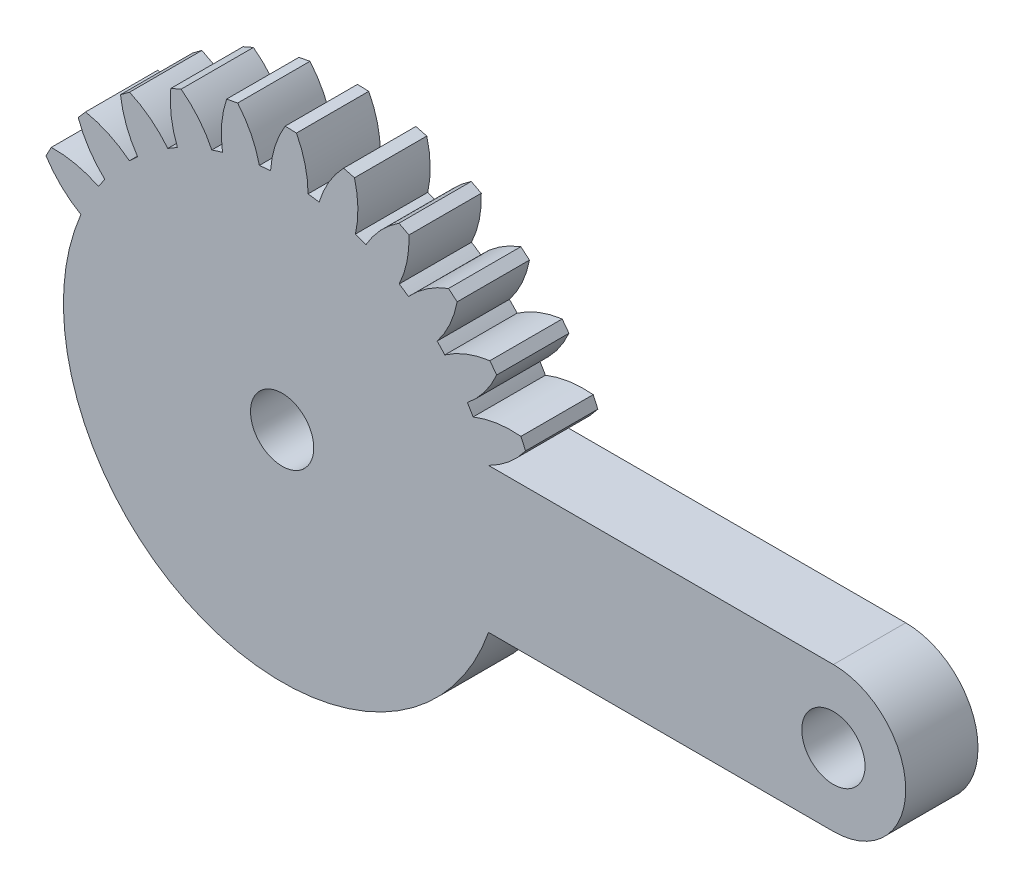
from build123d import *

# Parameters (mm, degrees)
SKETCH1_R           = 1.75
BOSS_EXTRUDE2_DEPTH = 4


with BuildPart() as part:
    # Sketch1 → Boss-Extrude2 (new body)
    # profile 1 of 12: a face of its own
    with BuildSketch(Plane.XY):
        with BuildLine():
            Line((30.5, -4), (11.419719786, -4))
            ThreePointArc((11.419719786, -4), (-12.1, 0), (11.419719786, 4))
            Line((11.419719786, 4), (30.5, 4))
            ThreePointArc((30.5, 4), (34.5, 0), (30.5, -4))
        make_face()
        Circle(SKETCH1_R, mode=Mode.SUBTRACT)
        with Locations((30.5, 0)):
            Circle(SKETCH1_R, mode=Mode.SUBTRACT)
    # profile 2 of 12: a face of its own
    with BuildSketch(Plane.XY):
        with BuildLine():
            ThreePointArc((2.04630572, 11.925713098), (3.062574606, 11.706008576), (4.056229837, 11.399868399))
            ThreePointArc((4.056229837, 11.399868399), (4.191789848, 12.739862338), (4.004557713, 14.073618088))
            Line((4.004557713, 14.073618088), (3.400741544, 14.231598069))
            ThreePointArc((3.400741544, 14.231598069), (2.585583316, 13.159679272), (2.04630572, 11.925713098))
        make_face()
    # profile 3 of 12: a face of its own
    with BuildSketch(Plane.XY):
        with BuildLine():
            ThreePointArc((-0.641917286, 12.082960821), (0.397776079, 12.093459976), (1.434532317, 12.014662585))
            ThreePointArc((1.434532317, 12.014662585), (1.27037575, 13.351454601), (0.792800193, 14.610772615))
            Line((0.792800193, 14.610772615), (0.168997044, 14.631297504))
            ThreePointArc((0.168997044, 14.631297504), (-0.388904138, 13.405638858), (-0.641917286, 12.082960821))
        make_face()
    # profile 4 of 12: a face of its own
    with BuildSketch(Plane.XY):
        with BuildLine():
            ThreePointArc((-3.071117398, 14.306350498), (-3.344130279, 12.987655382), (-3.298347959, 11.641773952))
            ThreePointArc((-3.298347959, 11.641773952), (-2.286723162, 11.881956791), (-1.258213497, 12.034404796))
            ThreePointArc((-1.258213497, 12.034404796), (-1.713956435, 13.301787393), (-2.458222459, 14.424297241))
            Line((-2.458222459, 14.424297241), (-3.071117398, 14.306350498))
        make_face()
    # profile 5 of 12: a face of its own
    with BuildSketch(Plane.XY):
        with BuildLine():
            ThreePointArc((-6.159128153, 13.272850751), (-6.133731183, 11.926430371), (-5.791420864, 10.624003218))
            ThreePointArc((-5.791420864, 10.624003218), (-4.857967527, 11.08197417), (-3.888643585, 11.458117257))
            ThreePointArc((-3.888643585, 11.458117257), (-4.613401246, 12.593320589), (-5.587496363, 13.523427559))
            Line((-5.587496363, 13.523427559), (-6.159128153, 13.272850751))
        make_face()
    # profile 6 of 12: a face of its own
    with BuildSketch(Plane.XY):
        with BuildLine():
            ThreePointArc((-8.942094855, 11.581984556), (-8.619545875, 10.274523276), (-7.997661209, 9.080055902))
            ThreePointArc((-7.997661209, 9.080055902), (-7.188610613, 9.733132972), (-6.326480245, 10.314341845))
            ThreePointArc((-6.326480245, 10.314341845), (-7.28435745, 11.261142529), (-8.440037507, 11.952781076))
            Line((-8.440037507, 11.952781076), (-8.942094855, 11.581984556))
        make_face()
    # profile 7 of 12: a face of its own
    with BuildSketch(Plane.XY):
        with BuildLine():
            ThreePointArc((-11.2821851, 9.317495695), (-10.67845904, 8.113748343), (-9.807800202, 7.086399311))
            ThreePointArc((-9.807800202, 7.086399311), (-9.163222316, 7.902237454), (-8.450984381, 8.659726496))
            ThreePointArc((-8.450984381, 8.659726496), (-9.594540202, 9.371232193), (-10.874567661, 9.790147432))
            Line((-10.874567661, 9.790147432), (-11.2821851, 9.317495695))
        make_face()
    # profile 8 of 12: a face of its own
    with BuildSketch(Plane.XY):
        with BuildLine():
            ThreePointArc((-13.06350089, 6.591537844), (-12.208498581, 5.551122593), (-11.13218682, 4.741773571))
            ThreePointArc((-11.13218682, 4.741773571), (-10.684005749, 5.67996665), (-10.15693536, 6.576219589))
            ThreePointArc((-10.15693536, 6.576219589), (-11.42953274, 7.017191451), (-12.770511491, 7.142635705))
            Line((-12.770511491, 7.142635705), (-13.06350089, 6.591537844))
        make_face()
    # profile 9 of 12: a face of its own
    with BuildSketch(Plane.XY):
        with BuildLine():
            ThreePointArc((4.633181039, 11.177818815), (5.575692546, 10.738791954), (6.47703386, 10.22047124))
            ThreePointArc((6.47703386, 10.22047124), (6.905596548, 11.497301024), (7.017980909, 12.839437391))
            Line((7.017980909, 12.839437391), (6.464057014, 13.127048167))
            ThreePointArc((6.464057014, 13.127048167), (5.432014202, 12.2619583), (4.633181039, 11.177818815))
        make_face()
    # profile 10 of 12: a face of its own
    with BuildSketch(Plane.XY):
        with BuildLine():
            ThreePointArc((6.990588114, 9.876319042), (7.812662335, 9.239713591), (8.577048867, 8.534883288))
            ThreePointArc((8.577048867, 8.534883288), (9.277388744, 9.685311177), (9.683823524, 10.969355975))
            Line((9.683823524, 10.969355975), (9.207226173, 11.372353004))
            ThreePointArc((9.207226173, 11.372353004), (8.009412915, 10.7569375), (6.990588114, 9.876319042))
        make_face()
    # profile 11 of 12: a face of its own
    with BuildSketch(Plane.XY):
        with BuildLine():
            ThreePointArc((9.001771295, 8.085673352), (9.662693238, 7.283018563), (10.252267103, 6.426586905))
            ThreePointArc((10.252267103, 6.426586905), (11.189698333, 7.393635488), (11.870053976, 8.555993639))
            Line((11.870053976, 8.555993639), (11.494387677, 9.054417628))
            ThreePointArc((11.494387677, 9.054417628), (10.190128247, 8.719156263), (9.001771295, 8.085673352))
        make_face()
    # profile 12 of 12: a face of its own
    with BuildSketch(Plane.XY):
        with BuildLine():
            ThreePointArc((10.567122415, 5.894567319), (11.034158501, 4.965616394), (11.419719786, 4))
            ThreePointArc((11.419719786, 4), (12.547814073, 4.735774119), (13.468394505, 5.718877338))
            Line((13.468394505, 5.718877338), (13.212264939, 6.288042768))
            ThreePointArc((13.212264939, 6.288042768), (11.866155587, 6.249540081), (10.567122415, 5.894567319))
        make_face()
    extrude(amount=BOSS_EXTRUDE2_DEPTH)


solid = part.part
